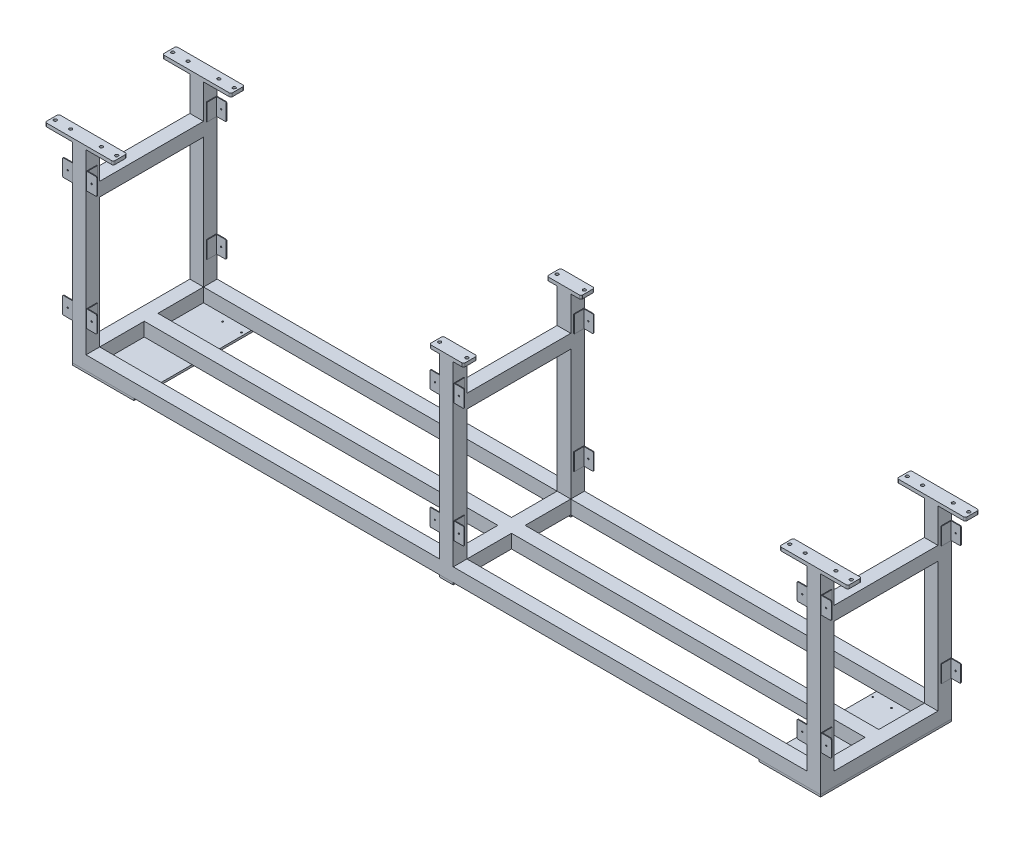
from build123d import *

# Parameters (mm, degrees)
SKETCH_1_W          = 200
SKETCH_1_H          = 10
SKETCH_1_W_2        = 100
EXTRUDE_1_DEPTH     = 40
SKETCH_17_R         = 2
EXTRUDE_2_DEPTH     = 2
SKETCH_33_W         = 2
SKETCH_33_H         = 50
EXTRUDE_3_DEPTH     = 30
SKETCH_34_W         = 40
SKETCH_34_H         = 40
EXTRUDE_4_DEPTH     = 192
SKETCH_35_R         = 4.5
CUT_EXTRUDE_1_DEPTH = 20
FILLET_1_R          = 5
SKETCH_42_W         = 1035
SKETCH_42_H         = 40
EXTRUDE_5_DEPTH     = 40
SKETCH_43_W         = 180
SKETCH_43_H         = 6
EXTRUDE_6_DEPTH     = 384
EXTRUDE_6_2_DEPTH   = 384
SKETCH_44_W         = 40
SKETCH_44_H         = 40
SKETCH_44_R         = 7
EXTRUDE_7_DEPTH     = 6
EXTRUDE_7_2_DEPTH   = 6
CUT_EXTRUDE_START   = -6
SKETCH_46_R         = 2.1
CUT_EXTRUDE_2_DEPTH = 6
SKETCH_47_R         = 7
CUT_EXTRUDE_3_DEPTH = 40


with BuildPart() as part:
    # 草图1 → 凸台-拉伸1 (new body)
    with BuildSketch(Plane.XY):
        with Locations((-1176.72628965, 368.32471578)):
            Rectangle(SKETCH_1_W, SKETCH_1_H)
        Polygon((-1186.72628965, -156.67528422), (-1156.72628965, -156.67528422), (-1156.72628965, -90.67528422), (-1156.72628965, -40.67528422), (-1156.72628965, 258.32471578), (-1156.72628965, 308.32471578), (-1156.72628965, 363.32471578), (-1196.72628965, 363.32471578), (-1196.72628965, 308.32471578), (-1196.72628965, 258.32471578), (-1196.72628965, -40.67528422), (-1196.72628965, -90.67528422), (-1196.72628965, -156.67528422), align=None)
        Polygon((-1186.72628965, -196.67528422), (-1156.72628965, -196.67528422), (-1156.72628965, -156.67528422), (-1186.72628965, -156.67528422), (-1196.72628965, -156.67528422), (-1196.72628965, -196.67528422), align=None)
        Polygon((-1016.72628965, -196.67528422), (-121.72628965, -196.67528422), (-121.72628965, -156.67528422), (-1156.72628965, -156.67528422), (-1156.72628965, -196.67528422), align=None)
        Polygon((-93.72628965, -196.67528422), (-81.72628965, -196.67528422), (-81.72628965, -156.67528422), (-81.72628965, -90.67528422), (-81.72628965, -40.67528422), (-81.72628965, 258.32471578), (-81.72628965, 308.32471578), (-81.72628965, 363.32471578), (-121.72628965, 363.32471578), (-121.72628965, 308.32471578), (-121.72628965, 258.32471578), (-121.72628965, -40.67528422), (-121.72628965, -90.67528422), (-121.72628965, -156.67528422), (-121.72628965, -196.67528422), (-109.72628965, -196.67528422), (-108.72628965, -196.67528422), (-94.72628965, -196.67528422), align=None)
        with Locations((-101.72628965, 368.32471578)):
            Rectangle(SKETCH_1_W_2, SKETCH_1_H)
        Polygon((-81.72628965, -156.67528422), (-81.72628965, -196.67528422), (813.27371035, -196.67528422), (953.27371035, -196.67528422), (953.27371035, -156.67528422), align=None)
        Polygon((953.27371035, -156.67528422), (953.27371035, -196.67528422), (993.27371035, -196.67528422), (993.27371035, -90.67528422), (993.27371035, -40.67528422), (993.27371035, 258.32471578), (993.27371035, 308.32471578), (993.27371035, 363.32471578), (953.27371035, 363.32471578), (953.27371035, 308.32471578), (953.27371035, 258.32471578), (953.27371035, -40.67528422), (953.27371035, -90.67528422), align=None)
        with Locations((973.27371035, 368.32471578)):
            Rectangle(SKETCH_1_W, SKETCH_1_H)
    extrude(amount=-EXTRUDE_1_DEPTH)

    # 草图17 → 凸台-拉伸2 (add)
    # profile 1 of 12: a face of its own
    with BuildSketch(Plane.XY.offset(-1.5)):
        with BuildLine():
            Line((-81.72628965, -40.67528422), (-81.72628965, -90.67528422))
            Line((-81.72628965, -90.67528422), (-54.72628965, -90.67528422))
            ThreePointArc((-54.72628965, -90.67528422), (-52.604969307, -89.796604564), (-51.72628965, -87.67528422))
            Line((-51.72628965, -87.67528422), (-51.72628965, -43.67528422))
            ThreePointArc((-51.72628965, -43.67528422), (-52.604969307, -41.553963877), (-54.72628965, -40.67528422))
            Line((-54.72628965, -40.67528422), (-81.72628965, -40.67528422))
        make_face()
        with Locations((-66.72628965, -65.67528422)):
            Circle(SKETCH_17_R, mode=Mode.SUBTRACT)
    # profile 2 of 12: a face of its own
    with BuildSketch(Plane.XY.offset(-1.5)):
        with BuildLine():
            Line((926.27371035, -90.67528422), (953.27371035, -90.67528422))
            Line((953.27371035, -90.67528422), (953.27371035, -40.67528422))
            Line((953.27371035, -40.67528422), (926.27371035, -40.67528422))
            ThreePointArc((926.27371035, -40.67528422), (924.152390006, -41.553963877), (923.27371035, -43.67528422))
            Line((923.27371035, -43.67528422), (923.27371035, -87.67528422))
            ThreePointArc((923.27371035, -87.67528422), (924.152390006, -89.796604564), (926.27371035, -90.67528422))
        make_face()
        with Locations((938.27371035, -65.67528422)):
            Circle(SKETCH_17_R, mode=Mode.SUBTRACT)
    # profile 3 of 12: a face of its own
    with BuildSketch(Plane.XY.offset(-1.5)):
        with BuildLine():
            Line((993.27371035, -40.67528422), (993.27371035, -90.67528422))
            Line((993.27371035, -90.67528422), (1020.27371035, -90.67528422))
            ThreePointArc((1020.27371035, -90.67528422), (1022.395030693, -89.796604564), (1023.27371035, -87.67528422))
            Line((1023.27371035, -87.67528422), (1023.27371035, -43.67528422))
            ThreePointArc((1023.27371035, -43.67528422), (1022.395030693, -41.553963877), (1020.27371035, -40.67528422))
            Line((1020.27371035, -40.67528422), (993.27371035, -40.67528422))
        make_face()
        with Locations((1008.27371035, -65.67528422)):
            Circle(SKETCH_17_R, mode=Mode.SUBTRACT)
    # profile 4 of 12: a face of its own
    with BuildSketch(Plane.XY.offset(-1.5)):
        with BuildLine():
            Line((-81.72628965, 308.32471578), (-81.72628965, 258.32471578))
            Line((-81.72628965, 258.32471578), (-54.72628965, 258.32471578))
            ThreePointArc((-54.72628965, 258.32471578), (-52.604969307, 259.203395436), (-51.72628965, 261.32471578))
            Line((-51.72628965, 261.32471578), (-51.72628965, 305.32471578))
            ThreePointArc((-51.72628965, 305.32471578), (-52.604969307, 307.446036123), (-54.72628965, 308.32471578))
            Line((-54.72628965, 308.32471578), (-81.72628965, 308.32471578))
        make_face()
        with Locations((-66.72628965, 283.32471578)):
            Circle(SKETCH_17_R, mode=Mode.SUBTRACT)
    # profile 5 of 12: a face of its own
    with BuildSketch(Plane.XY.offset(-1.5)):
        with BuildLine():
            Line((926.27371035, 258.32471578), (953.27371035, 258.32471578))
            Line((953.27371035, 258.32471578), (953.27371035, 308.32471578))
            Line((953.27371035, 308.32471578), (926.27371035, 308.32471578))
            ThreePointArc((926.27371035, 308.32471578), (924.152390006, 307.446036123), (923.27371035, 305.32471578))
            Line((923.27371035, 305.32471578), (923.27371035, 261.32471578))
            ThreePointArc((923.27371035, 261.32471578), (924.152390006, 259.203395436), (926.27371035, 258.32471578))
        make_face()
        with Locations((938.27371035, 283.32471578)):
            Circle(SKETCH_17_R, mode=Mode.SUBTRACT)
    # profile 6 of 12: a face of its own
    with BuildSketch(Plane.XY.offset(-1.5)):
        with BuildLine():
            Line((993.27371035, 308.32471578), (993.27371035, 258.32471578))
            Line((993.27371035, 258.32471578), (1020.27371035, 258.32471578))
            ThreePointArc((1020.27371035, 258.32471578), (1022.395030693, 259.203395436), (1023.27371035, 261.32471578))
            Line((1023.27371035, 261.32471578), (1023.27371035, 305.32471578))
            ThreePointArc((1023.27371035, 305.32471578), (1022.395030693, 307.446036123), (1020.27371035, 308.32471578))
            Line((1020.27371035, 308.32471578), (993.27371035, 308.32471578))
        make_face()
        with Locations((1008.27371035, 283.32471578)):
            Circle(SKETCH_17_R, mode=Mode.SUBTRACT)
    # profile 7 of 12: a face of its own
    with BuildSketch(Plane.XY.offset(-1.5)):
        with BuildLine():
            Line((-148.72628965, -90.67528422), (-121.72628965, -90.67528422))
            Line((-121.72628965, -90.67528422), (-121.72628965, -40.67528422))
            Line((-121.72628965, -40.67528422), (-148.72628965, -40.67528422))
            ThreePointArc((-148.72628965, -40.67528422), (-150.847609994, -41.553963877), (-151.72628965, -43.67528422))
            Line((-151.72628965, -43.67528422), (-151.72628965, -87.67528422))
            ThreePointArc((-151.72628965, -87.67528422), (-150.847609994, -89.796604564), (-148.72628965, -90.67528422))
        make_face()
        with Locations((-136.72628965, -65.67528422)):
            Circle(SKETCH_17_R, mode=Mode.SUBTRACT)
    # profile 8 of 12: a face of its own
    with BuildSketch(Plane.XY.offset(-1.5)):
        with BuildLine():
            Line((-1156.72628965, -40.67528422), (-1156.72628965, -90.67528422))
            Line((-1156.72628965, -90.67528422), (-1129.72628965, -90.67528422))
            ThreePointArc((-1129.72628965, -90.67528422), (-1127.604969307, -89.796604564), (-1126.72628965, -87.67528422))
            Line((-1126.72628965, -87.67528422), (-1126.72628965, -43.67528422))
            ThreePointArc((-1126.72628965, -43.67528422), (-1127.604969307, -41.553963877), (-1129.72628965, -40.67528422))
            Line((-1129.72628965, -40.67528422), (-1156.72628965, -40.67528422))
        make_face()
        with Locations((-1141.72628965, -65.67528422)):
            Circle(SKETCH_17_R, mode=Mode.SUBTRACT)
    # profile 9 of 12: a face of its own
    with BuildSketch(Plane.XY.offset(-1.5)):
        with BuildLine():
            Line((-121.72628965, 258.32471578), (-121.72628965, 308.32471578))
            Line((-121.72628965, 308.32471578), (-148.72628965, 308.32471578))
            ThreePointArc((-148.72628965, 308.32471578), (-150.847609994, 307.446036123), (-151.72628965, 305.32471578))
            Line((-151.72628965, 305.32471578), (-151.72628965, 261.32471578))
            ThreePointArc((-151.72628965, 261.32471578), (-150.847609994, 259.203395436), (-148.72628965, 258.32471578))
            Line((-148.72628965, 258.32471578), (-121.72628965, 258.32471578))
        make_face()
        with Locations((-136.72628965, 283.32471578)):
            Circle(SKETCH_17_R, mode=Mode.SUBTRACT)
    # profile 10 of 12: a face of its own
    with BuildSketch(Plane.XY.offset(-1.5)):
        with BuildLine():
            Line((-1223.72628965, -90.67528422), (-1196.72628965, -90.67528422))
            Line((-1196.72628965, -90.67528422), (-1196.72628965, -40.67528422))
            Line((-1196.72628965, -40.67528422), (-1223.72628965, -40.67528422))
            ThreePointArc((-1223.72628965, -40.67528422), (-1225.847609994, -41.553963877), (-1226.72628965, -43.67528422))
            Line((-1226.72628965, -43.67528422), (-1226.72628965, -87.67528422))
            ThreePointArc((-1226.72628965, -87.67528422), (-1225.847609994, -89.796604564), (-1223.72628965, -90.67528422))
        make_face()
        with Locations((-1211.72628965, -65.67528422)):
            Circle(SKETCH_17_R, mode=Mode.SUBTRACT)
    # profile 11 of 12: a face of its own
    with BuildSketch(Plane.XY.offset(-1.5)):
        with BuildLine():
            Line((-1156.72628965, 308.32471578), (-1156.72628965, 258.32471578))
            Line((-1156.72628965, 258.32471578), (-1129.72628965, 258.32471578))
            ThreePointArc((-1129.72628965, 258.32471578), (-1127.604969307, 259.203395436), (-1126.72628965, 261.32471578))
            Line((-1126.72628965, 261.32471578), (-1126.72628965, 305.32471578))
            ThreePointArc((-1126.72628965, 305.32471578), (-1127.604969307, 307.446036123), (-1129.72628965, 308.32471578))
            Line((-1129.72628965, 308.32471578), (-1156.72628965, 308.32471578))
        make_face()
        with Locations((-1141.72628965, 283.32471578)):
            Circle(SKETCH_17_R, mode=Mode.SUBTRACT)
    # profile 12 of 12: a face of its own
    with BuildSketch(Plane.XY.offset(-1.5)):
        with BuildLine():
            Line((-1223.72628965, 258.32471578), (-1196.72628965, 258.32471578))
            Line((-1196.72628965, 258.32471578), (-1196.72628965, 308.32471578))
            Line((-1196.72628965, 308.32471578), (-1223.72628965, 308.32471578))
            ThreePointArc((-1223.72628965, 308.32471578), (-1225.847609994, 307.446036123), (-1226.72628965, 305.32471578))
            Line((-1226.72628965, 305.32471578), (-1226.72628965, 261.32471578))
            ThreePointArc((-1226.72628965, 261.32471578), (-1225.847609994, 259.203395436), (-1223.72628965, 258.32471578))
        make_face()
        with Locations((-1211.72628965, 283.32471578)):
            Circle(SKETCH_17_R, mode=Mode.SUBTRACT)
    extrude(amount=-EXTRUDE_2_DEPTH)

    # 草图33 → 凸台-拉伸3 (add)
    with BuildSketch(Plane.XY.offset(-1.5)):
        with Locations((-122.72628965, -65.67528422)):
            Rectangle(SKETCH_33_W, SKETCH_33_H)
        with Locations((-1197.72628965, 283.32471578)):
            Rectangle(SKETCH_33_W, SKETCH_33_H)
        with Locations((-1155.72628965, 283.32471578)):
            Rectangle(SKETCH_33_W, SKETCH_33_H)
        with Locations((-1197.72628965, -65.67528422)):
            Rectangle(SKETCH_33_W, SKETCH_33_H)
        with Locations((-1155.72628965, -65.67528422)):
            Rectangle(SKETCH_33_W, SKETCH_33_H)
        with Locations((-80.72628965, 283.32471578)):
            Rectangle(SKETCH_33_W, SKETCH_33_H)
        with Locations((-122.72628965, 283.32471578)):
            Rectangle(SKETCH_33_W, SKETCH_33_H)
        with Locations((-80.72628965, -65.67528422)):
            Rectangle(SKETCH_33_W, SKETCH_33_H)
        with Locations((952.27371035, -65.67528422)):
            Rectangle(SKETCH_33_W, SKETCH_33_H)
        with Locations((994.27371035, 283.32471578)):
            Rectangle(SKETCH_33_W, SKETCH_33_H)
        with Locations((994.27371035, -65.67528422)):
            Rectangle(SKETCH_33_W, SKETCH_33_H)
        with Locations((952.27371035, 283.32471578)):
            Rectangle(SKETCH_33_W, SKETCH_33_H)
    extrude(amount=-EXTRUDE_3_DEPTH)

    # 草图34 → 凸台-拉伸4 (add)
    with BuildSketch(Plane.XY):
        with Locations((-1176.72628965, 243.32471578)):
            Rectangle(SKETCH_34_W, SKETCH_34_H)
        with Locations((-1176.72628965, -176.67528422)):
            Rectangle(SKETCH_34_W, SKETCH_34_H)
        with Locations((-101.72628965, 243.32471578)):
            Rectangle(SKETCH_34_W, SKETCH_34_H)
        with Locations((-101.72628965, -176.67528422)):
            Rectangle(SKETCH_34_W, SKETCH_34_H)
        with Locations((973.27371035, 243.32471578)):
            Rectangle(SKETCH_34_W, SKETCH_34_H)
        with Locations((973.27371035, -176.67528422)):
            Rectangle(SKETCH_34_W, SKETCH_34_H)
    extrude(amount=-EXTRUDE_4_DEPTH)

    # 草图35 → 切除-拉伸1 (cut)
    with BuildSketch(Plane(origin=(0, 373.32471578, 0), x_dir=(1, 0, 0), z_dir=(0, 1, 0))):
        with Locations(Location((-141.72628965, 20, 0), (0, 0, 270))):
            Circle(SKETCH_35_R)
        with Locations(Location((-61.72628965, 20, 0), (0, 0, 270))):
            Circle(SKETCH_35_R)
        with Locations(Location((883.27371035, 20, 0), (0, 0, 270))):
            Circle(SKETCH_35_R)
        with BuildLine():
            ThreePointArc((-1082.814304142, 22.224043477), (-1091.14164558, 19.131304421), (-1082.263347889, 19.423674716))
            ThreePointArc((-1082.263347889, 19.423674716), (-1083.335041719, 20.518644998), (-1083.72628965, 22))
            Line((-1083.72628965, 22), (-1082.82628965, 22))
            ThreePointArc((-1082.82628965, 22), (-1082.823291132, 22.112181919), (-1082.814304142, 22.224043477))
        make_face()
        with Locations(Location((1063.27371035, 20, 0), (0, 0, 270))):
            Circle(SKETCH_35_R)
        with Locations(Location((1018.27371035, 20, 0), (0, 0, 270))):
            Circle(SKETCH_35_R)
        with Locations(Location((928.27371035, 20, 0), (0, 0, 270))):
            Circle(SKETCH_35_R)
        with Locations(Location((-1266.72628965, 20, 0), (0, 0, 270))):
            Circle(SKETCH_35_R)
        with Locations(Location((-1221.72628965, 20, 0), (0, 0, 270))):
            Circle(SKETCH_35_R)
        with Locations(Location((-1131.72628965, 20, 0), (0, 0, 270))):
            Circle(SKETCH_35_R)
    extrude(amount=-CUT_EXTRUDE_1_DEPTH, mode=Mode.SUBTRACT)

    # 镜向1: part across plane


with BuildPart() as part_1:
    add(part.part)
    add(part.part.mirror(Plane.XY.offset(-192)))

    # 圆角1
    fillet_1_edges = [part_1.edges().sort_by_distance(p)[0] for p in [
        (-1276.72628965, 368.32471578, -40),
        (-51.72628965, 368.32471578, -40),
        (-151.72628965, 368.32471578, -40),
        (-1076.72628965, 368.32471578, -40),
        (-1076.72628965, 368.32471578, 0),
        (-151.72628965, 368.32471578, 0),
        (-51.72628965, 368.32471578, 0),
        (873.27371035, 368.32471578, 0),
        (1073.27371035, 368.32471578, 0),
        (-1276.72628965, 368.32471578, 0),
        (1073.27371035, 368.32471578, -40),
        (873.27371035, 368.32471578, -40),
        (873.27371035, 368.32471578, -344),
        (-151.72628965, 368.32471578, -344),
        (-1276.72628965, 368.32471578, -344),
        (-1076.72628965, 368.32471578, -344),
        (-151.72628965, 368.32471578, -384),
        (-51.72628965, 368.32471578, -344),
        (873.27371035, 368.32471578, -384),
        (1073.27371035, 368.32471578, -344),
        (-1276.72628965, 368.32471578, -384),
        (1073.27371035, 368.32471578, -384),
        (-1076.72628965, 368.32471578, -384),
        (-51.72628965, 368.32471578, -384),
    ]]
    fillet(fillet_1_edges, radius=FILLET_1_R)

    # 草图42 → 凸台-拉伸5 (add)
    with BuildSketch(Plane(origin=(0, -156.67528422, 0), x_dir=(1, 0, 0), z_dir=(0, 1, 0))):
        with Locations((-639.22628965, 190.535533906)):
            Rectangle(SKETCH_42_W, SKETCH_42_H)
        with Locations((435.77371035, 190.535533906)):
            Rectangle(SKETCH_42_W, SKETCH_42_H)
    extrude(amount=-EXTRUDE_5_DEPTH)


with BuildPart() as body_2:
    # 草图43 → 凸台-拉伸6 (new body)
    with BuildSketch(Plane.XY):
        with Locations((-1106.72628965, -199.67528422)):
            Rectangle(SKETCH_43_W, SKETCH_43_H)
    extrude(amount=-EXTRUDE_6_DEPTH)


with BuildPart() as body_3:
    # 草图43 → Extrude 6 2 (new body)
    with BuildSketch(Plane.XY):
        with Locations((903.27371035, -199.67528422)):
            Rectangle(SKETCH_43_W, SKETCH_43_H)
    extrude(amount=-EXTRUDE_6_2_DEPTH)


with BuildPart() as body_4:
    # 草图44 → 凸台-拉伸7 (new body)
    with BuildSketch(Plane.XZ.offset(196.67528422)):
        with Locations((-101.72628965, -20)):
            Rectangle(SKETCH_44_W, SKETCH_44_H)
        with Locations(Location((-101.72628965, -20, 0), (0, 0, 270))):
            Circle(SKETCH_44_R, mode=Mode.SUBTRACT)
    extrude(amount=EXTRUDE_7_DEPTH)


with BuildPart() as body_5:
    # 草图44 → Extrude 7 2 (new body)
    with BuildSketch(Plane.XZ.offset(196.67528422)):
        with Locations((-101.72628965, -364)):
            Rectangle(SKETCH_44_W, SKETCH_44_H)
        with Locations(Location((-101.72628965, -364, 0), (0, 0, 270))):
            Circle(SKETCH_44_R, mode=Mode.SUBTRACT)
    extrude(amount=EXTRUDE_7_2_DEPTH)


with BuildPart() as cut_extrude_2_tool:
    # 草图46 → 切除-拉伸2 (new body)
    with BuildSketch(Plane.XZ.offset(202.67528422).offset(CUT_EXTRUDE_START)):
        with Locations(Location((822.27371035, -22, 0), (0, 0, 270))):
            Circle(SKETCH_46_R)
        with Locations(Location((877.27371035, -22, 0), (0, 0, 270))):
            Circle(SKETCH_46_R)
        with Locations(Location((877.27371035, -60, 0), (0, 0, 270))):
            Circle(SKETCH_46_R)
        with Locations(Location((822.27371035, -60, 0), (0, 0, 270))):
            Circle(SKETCH_46_R)
        with Locations(Location((-1080.72628965, -22, 0), (0, 0, 270))):
            Circle(SKETCH_46_R)
        with Locations(Location((-1025.72628965, -22, 0), (0, 0, 270))):
            Circle(SKETCH_46_R)
        with Locations(Location((-1080.72628965, -60, 0), (0, 0, 270))):
            Circle(SKETCH_46_R)
        with Locations(Location((-1025.72628965, -60, 0), (0, 0, 270))):
            Circle(SKETCH_46_R)
        with Locations(Location((-1025.72628965, -324, 0), (0, 0, 90))):
            Circle(SKETCH_46_R)
        with Locations(Location((-1080.72628965, -324, 0), (0, 0, 90))):
            Circle(SKETCH_46_R)
        with Locations(Location((-1025.72628965, -362, 0), (0, 0, 90))):
            Circle(SKETCH_46_R)
        with Locations(Location((-1080.72628965, -362, 0), (0, 0, 90))):
            Circle(SKETCH_46_R)
        with Locations(Location((822.27371035, -324, 0), (0, 0, 90))):
            Circle(SKETCH_46_R)
        with Locations(Location((877.27371035, -324, 0), (0, 0, 90))):
            Circle(SKETCH_46_R)
        with Locations(Location((877.27371035, -362, 0), (0, 0, 90))):
            Circle(SKETCH_46_R)
        with Locations(Location((822.27371035, -362, 0), (0, 0, 90))):
            Circle(SKETCH_46_R)
    extrude(amount=CUT_EXTRUDE_2_DEPTH)


with BuildPart() as body_2_1:
    add(body_2.part)

    # 切除-拉伸2: cut by cut_extrude_2_tool
    add(cut_extrude_2_tool.part, mode=Mode.SUBTRACT)


with BuildPart() as body_3_1:
    add(body_3.part)

    # 切除-拉伸2: cut by cut_extrude_2_tool
    add(cut_extrude_2_tool.part, mode=Mode.SUBTRACT)


with BuildPart() as cut_extrude_3_tool:
    # 草图47 → 切除-拉伸3 (new body)
    with BuildSketch(Plane.XZ.offset(202.67528422)):
        with Locations(Location((-1176.72628965, -20, 0), (0, 0, 270))):
            Circle(SKETCH_47_R)
        with Locations(Location((-1176.72628965, -364, 0), (0, 0, 90))):
            Circle(SKETCH_47_R)
        with Locations(Location((973.27371035, -364, 0), (0, 0, 270))):
            Circle(SKETCH_47_R)
        with Locations(Location((973.27371035, -20, 0), (0, 0, 90))):
            Circle(SKETCH_47_R)
    extrude(amount=-CUT_EXTRUDE_3_DEPTH)


with BuildPart() as part_2:
    add(part_1.part)

    # 切除-拉伸3: cut by cut_extrude_3_tool
    add(cut_extrude_3_tool.part, mode=Mode.SUBTRACT)


with BuildPart() as body_2_2:
    add(body_2_1.part)

    # 切除-拉伸3: cut by cut_extrude_3_tool
    add(cut_extrude_3_tool.part, mode=Mode.SUBTRACT)


with BuildPart() as body_3_2:
    add(body_3_1.part)

    # 切除-拉伸3: cut by cut_extrude_3_tool
    add(cut_extrude_3_tool.part, mode=Mode.SUBTRACT)


solid = Compound([body_4.part, body_5.part, part_2.part, body_2_2.part, body_3_2.part])
